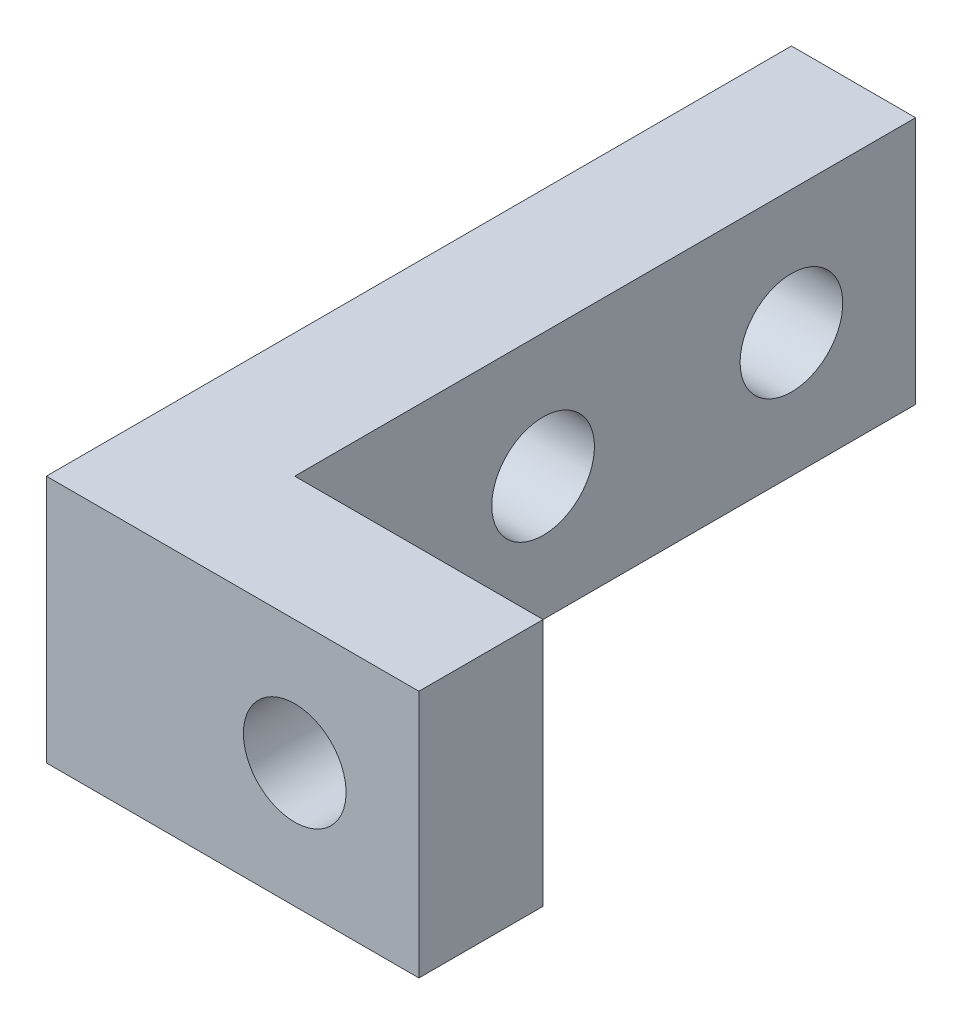
from build123d import *

# Parameters (mm, degrees)
SKETCH1_W                 = 6.35
SKETCH1_H                 = 38.1
SKETCH1_W_2               = 12.7
SKETCH1_H_2               = 6.35
BOSS_EXTRUDE1_DEPTH       = 12.7
F_5_0MM_DOWEL_HOLE1_D     = 5.25
F_5_0MM_DOWEL_HOLE1_DEPTH = 9.906
F_5_0MM_DOWEL_HOLE1_TIP   = 1.577259125
F_5_0MM_DOWEL_HOLE2_D     = 5.25
F_5_0MM_DOWEL_HOLE2_DEPTH = 9.906
F_5_0MM_DOWEL_HOLE2_TIP   = 1.577259125


with BuildPart() as part:
    # Sketch1 → Boss-Extrude1 (new body)
    with BuildSketch(Plane(origin=(0, 0, 0), x_dir=(1, 0, 0), z_dir=(0, 1, 0))):
        with Locations((3.175, 19.05)):
            Rectangle(SKETCH1_W, SKETCH1_H)
        with Locations((12.7, 3.175)):
            Rectangle(SKETCH1_W_2, SKETCH1_H_2)
    extrude(amount=BOSS_EXTRUDE1_DEPTH)

    # Ø5.0mm Dowel Hole1
    with Locations(Plane.ZY):
        with Locations((-31.75, 6.35), (-19.05, 6.35)):
            Hole(F_5_0MM_DOWEL_HOLE1_D / 2, depth=F_5_0MM_DOWEL_HOLE1_DEPTH)
            with Locations((0, 0, -(F_5_0MM_DOWEL_HOLE1_DEPTH + F_5_0MM_DOWEL_HOLE1_TIP / 2))):  # 118° drill point
                Cone(0, F_5_0MM_DOWEL_HOLE1_D / 2, F_5_0MM_DOWEL_HOLE1_TIP, mode=Mode.SUBTRACT)

    # Ø5.0mm Dowel Hole2
    with Locations(Plane(origin=(0, 0, -6.35), x_dir=(-1, 0, 0), z_dir=(0, 0, -1))):
        with Locations((-12.7, 6.35)):
            Hole(F_5_0MM_DOWEL_HOLE2_D / 2, depth=F_5_0MM_DOWEL_HOLE2_DEPTH)
            with Locations((0, 0, -(F_5_0MM_DOWEL_HOLE2_DEPTH + F_5_0MM_DOWEL_HOLE2_TIP / 2))):  # 118° drill point
                Cone(0, F_5_0MM_DOWEL_HOLE2_D / 2, F_5_0MM_DOWEL_HOLE2_TIP, mode=Mode.SUBTRACT)


solid = part.part
